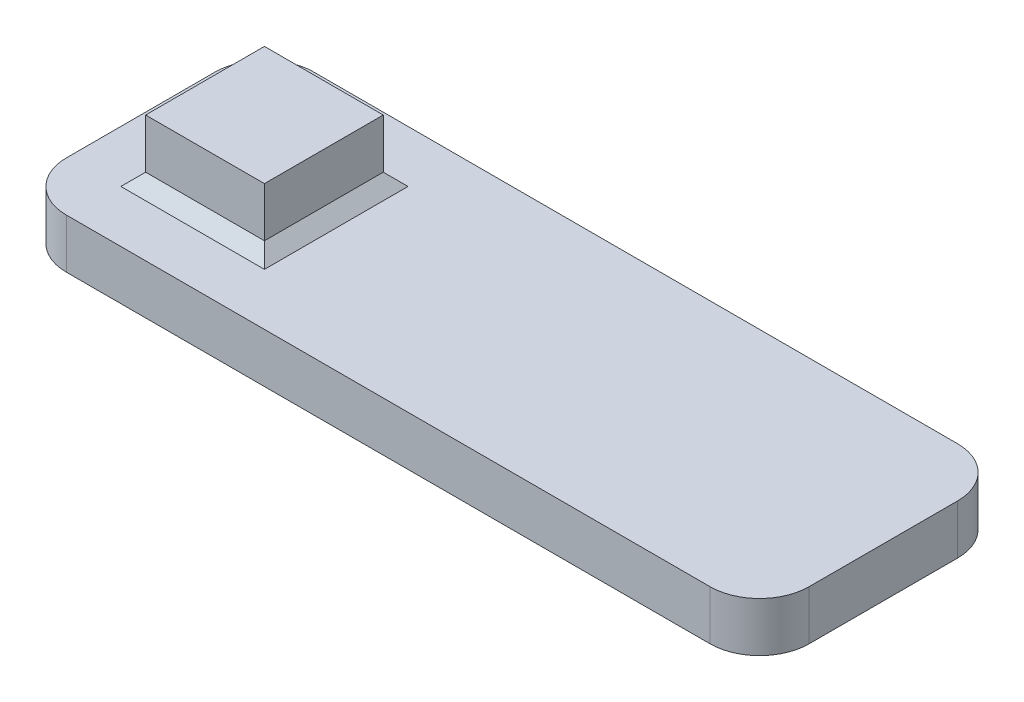
from build123d import *

# Parameters (mm, degrees)
ESBO_O3_W                = 30
ESBO_O3_H                = 10
RESSALTO_EXTRUS_O3_DEPTH = 2
ESBO_O4_W                = 4.8
ESBO_O4_H                = 4.8
RESSALTO_EXTRUS_O4_DEPTH = 2.5
CHANFRO2_SIZE            = 0.5
FILETE5_R                = 2
FILETE6_R                = 2
FILETE7_R                = 2
FILETE8_R                = 2


with BuildPart() as part:
    # Esboço3 → Ressalto-extrusão3 (new body)
    with BuildSketch(Plane(origin=(0, 0, 0), x_dir=(1, 0, 0), z_dir=(0, 1, 0))):
        with Locations((15, 5)):
            Rectangle(ESBO_O3_W, ESBO_O3_H)
    extrude(amount=RESSALTO_EXTRUS_O3_DEPTH)

    # Esboço4 → Ressalto-extrusão4 (add)
    with BuildSketch(Plane(origin=(0, 2, 0), x_dir=(1, 0, 0), z_dir=(0, 1, 0))):
        with Locations((5, 5)):
            Rectangle(ESBO_O4_W, ESBO_O4_H)
    extrude(amount=RESSALTO_EXTRUS_O4_DEPTH)

    # Chanfro2
    chanfro2_edges = [part.edges().sort_by_distance(p)[0] for p in [
        (7.4, 2, -5),
        (5, 2, -7.4),
        (2.6, 2, -5),
        (5, 2, -2.6),
    ]]
    chamfer(chanfro2_edges, length=CHANFRO2_SIZE)

    # Filete5
    filete5_edges = [part.edges().sort_by_distance(p)[0] for p in [
        (0, 1, 0),
    ]]
    fillet(filete5_edges, radius=FILETE5_R)

    # Filete6
    filete6_edges = [part.edges().sort_by_distance(p)[0] for p in [
        (0, 1, -10),
    ]]
    fillet(filete6_edges, radius=FILETE6_R)

    # Filete7
    filete7_edges = [part.edges().sort_by_distance(p)[0] for p in [
        (30, 1, -10),
    ]]
    fillet(filete7_edges, radius=FILETE7_R)

    # Filete8
    filete8_edges = [part.edges().sort_by_distance(p)[0] for p in [
        (30, 1, 0),
    ]]
    fillet(filete8_edges, radius=FILETE8_R)


solid = part.part
